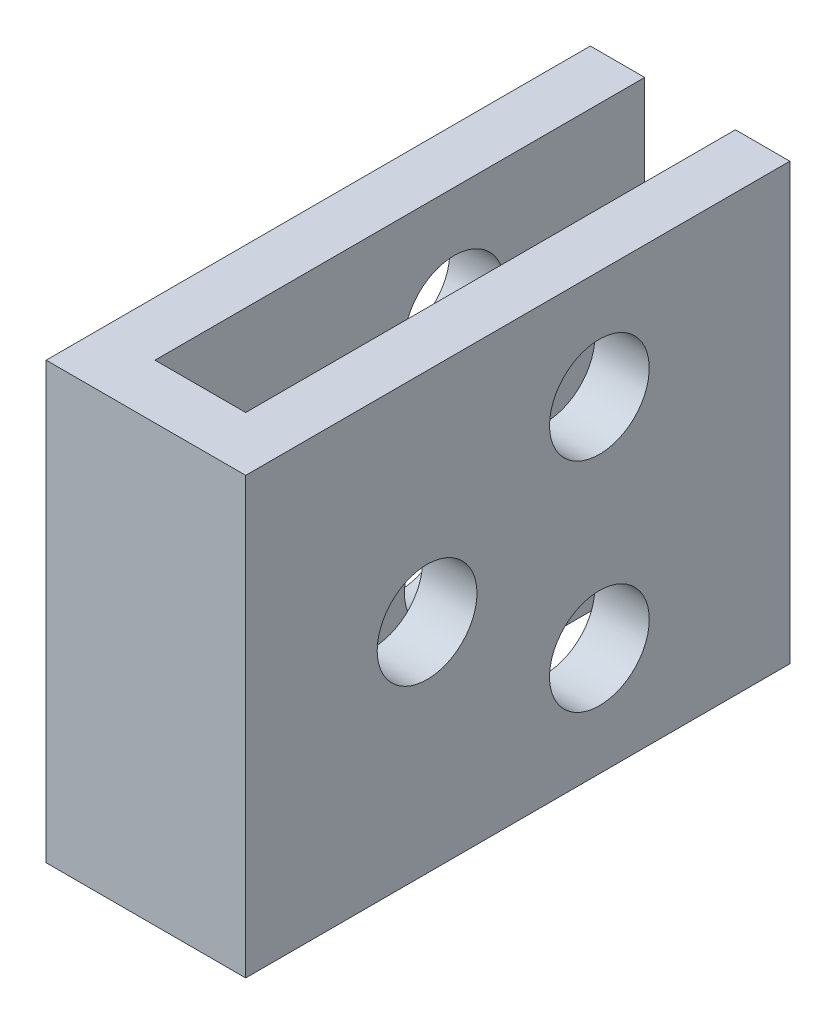
from build123d import *

# Parameters (mm, degrees)
EXTRUDE_1_DEPTH     = 12
SKETCH_5_R          = 2.75
CUT_EXTRUDE_1_DEPTH = 35.132096332


with BuildPart() as part:
    # 草图1 → 凸台-拉伸1 (new, symmetric)
    with BuildSketch(Plane(origin=(0, 0, 0), x_dir=(1, 0, 0), z_dir=(0, 1, 0))):
        Polygon((5.5, 0), (-5.5, 0), (-5.5, 30), (-2.5, 30), (-2.5, 3), (2.5, 3), (2.5, 30), (5.5, 30), align=None)
    extrude(amount=EXTRUDE_1_DEPTH, both=True)

    # 草图5 → 切除-拉伸1 (cut, through all)
    with BuildSketch(Plane.ZY.offset(5.5)):
        with Locations((-10, 0)):
            Circle(SKETCH_5_R)
        with Locations((-19.5, 6)):
            Circle(SKETCH_5_R)
        with Locations((-19.5, -6)):
            Circle(SKETCH_5_R)
    extrude(amount=-CUT_EXTRUDE_1_DEPTH, mode=Mode.SUBTRACT)


solid = part.part
